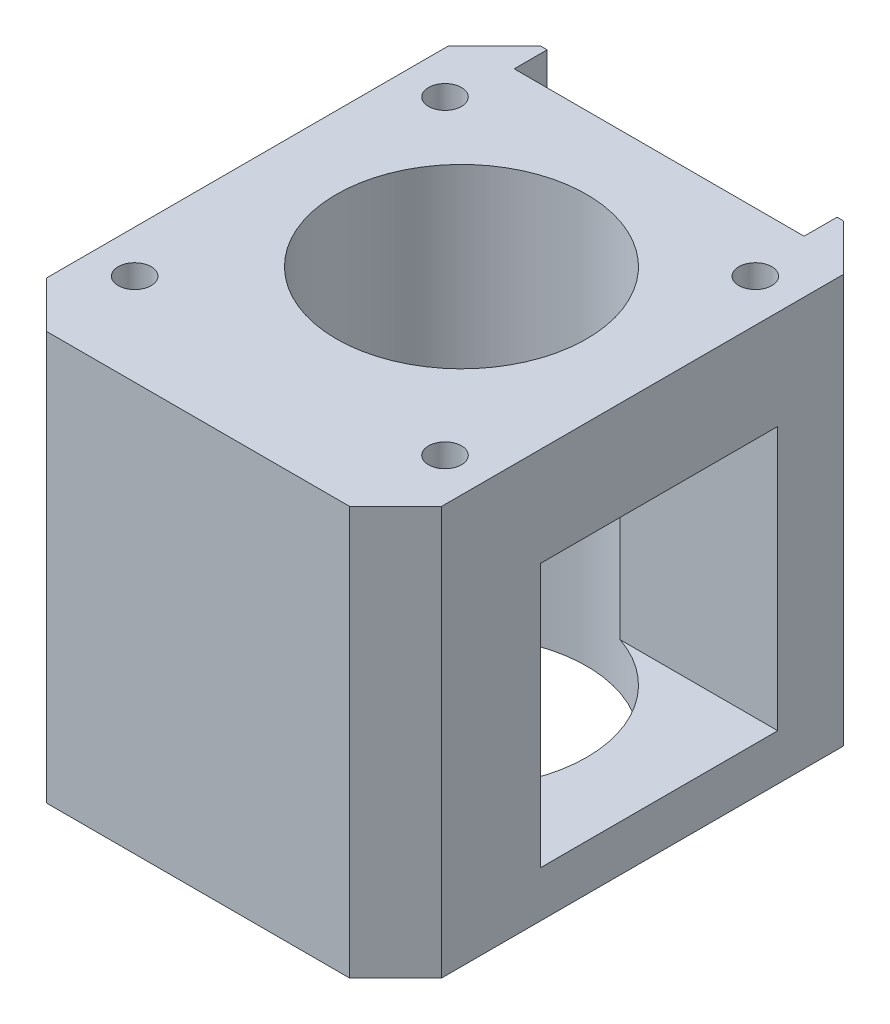
from build123d import *

# Parameters (mm, degrees)
SKETCH1_W               = 60
SKETCH1_H               = 75
BOSS_EXTRUDE1_DEPTH     = 62
SKETCH2_R               = 19
SKETCH2_W               = 44
SKETCH2_H               = 5
CUT_EXTRUDE1_DEPTH      = 62
CUT_EXTRUDE2_REACH      = 96.076
CUT_EXTRUDE2_END_RADIUS = 19
SKETCH3_W               = 36
SKETCH3_H               = 40
CHAMFER1_SIZE           = 7
SKETCH4_R               = 2.5
CUT_EXTRUDE3_DEPTH      = 10
SKETCH5_R               = 2.5
CUT_EXTRUDE4_DEPTH      = 20


with BuildPart() as part:
    # Sketch1 → Boss-Extrude1 (new body)
    with BuildSketch(Plane(origin=(0, 0, 0), x_dir=(1, 0, 0), z_dir=(0, 1, 0))):
        Rectangle(SKETCH1_W, SKETCH1_H)
    extrude(amount=BOSS_EXTRUDE1_DEPTH)

    # Sketch2 → Cut-Extrude1 (cut)
    with BuildSketch(Plane(origin=(0, 62, 0), x_dir=(1, 0, 0), z_dir=(0, 1, 0))):
        with Locations(Location((0, 2.5, 0), (0, 0, 270))):
            Circle(SKETCH2_R)
        with Locations((0, 35)):
            Rectangle(SKETCH2_W, SKETCH2_H)
    extrude(amount=-CUT_EXTRUDE1_DEPTH, mode=Mode.SUBTRACT)

    # Cut-Extrude2: up to this cylinder (the profile starts outside it)
    cut_extrude2_end = Plane(origin=(0, 27, -2.5), z_dir=(0, 1, 0)) * Cylinder(CUT_EXTRUDE2_END_RADIUS, 231.152, mode=Mode.PRIVATE)
    # Sketch3 → Cut-Extrude2 (cut, up to the surface)
    with BuildSketch(Plane(origin=(30, 0, 0), x_dir=(0, 0, -1), z_dir=(1, 0, 0)), mode=Mode.PRIVATE) as cut_extrude2_sk1:
        with Locations((2.5, 27)):
            Rectangle(SKETCH3_W, SKETCH3_H)
    cut_extrude2_tool1 = extrude(cut_extrude2_sk1.sketch, amount=-CUT_EXTRUDE2_REACH, mode=Mode.PRIVATE) - cut_extrude2_end
    add(cut_extrude2_tool1.solids().sort_by_distance((30, 27, -2.5))[0], mode=Mode.SUBTRACT)

    # Chamfer1
    chamfer1_edges = [part.edges().sort_by_distance(p)[0] for p in [
        (30, 31, 37.5),
        (-30, 31, 37.5),
        (-30, 31, -37.5),
        (30, 31, -37.5),
    ]]
    chamfer(chamfer1_edges, length=CHAMFER1_SIZE)

    # Sketch4 → Cut-Extrude3 (cut)
    with BuildSketch(Plane(origin=(0, 0, -32.5), x_dir=(-1, 0, 0), z_dir=(0, 0, -1))):
        with Locations((-14, 53)):
            Circle(SKETCH4_R)
        with Locations((14, 53)):
            Circle(SKETCH4_R)
        with Locations((-14, 9)):
            Circle(SKETCH4_R)
        with Locations((14, 9)):
            Circle(SKETCH4_R)
    extrude(amount=-CUT_EXTRUDE3_DEPTH, mode=Mode.SUBTRACT)

    # Sketch5 → Cut-Extrude4 (cut)
    with BuildSketch(Plane(origin=(0, 62, 0), x_dir=(1, 0, 0), z_dir=(0, 1, 0))):
        with Locations(Location((-23.55, 23.55, 0), (0, 0, 270))):
            Circle(SKETCH5_R)
        with Locations(Location((23.55, 23.55, 0), (0, 0, 270))):
            Circle(SKETCH5_R)
        with Locations(Location((23.55, -23.55, 0), (0, 0, 270))):
            Circle(SKETCH5_R)
        with Locations(Location((-23.55, -23.55, 0), (0, 0, 270))):
            Circle(SKETCH5_R)
    extrude(amount=-CUT_EXTRUDE4_DEPTH, mode=Mode.SUBTRACT)


solid = part.part
